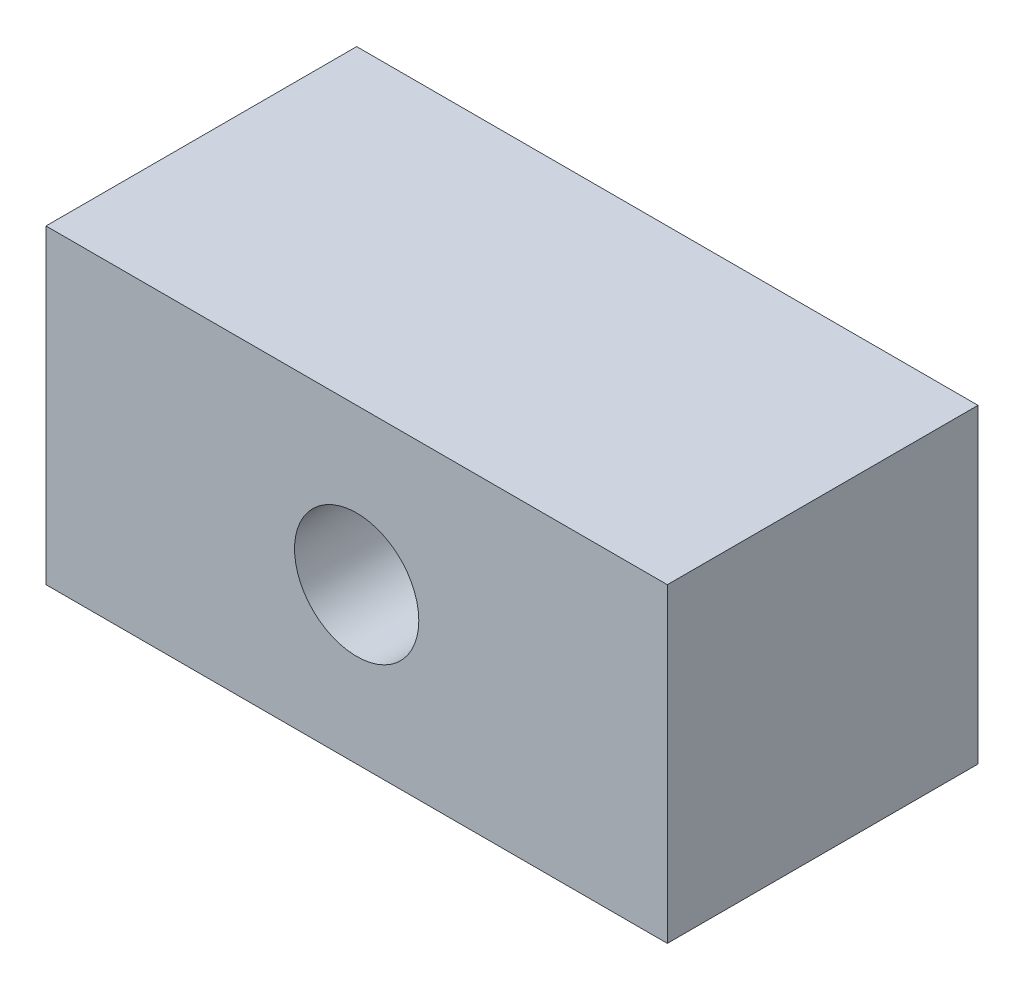
from build123d import *

# Parameters (mm, degrees)
SKETCH1_W           = 40
SKETCH1_H           = 20
BOSS_EXTRUDE1_DEPTH = 10
SKETCH2_R           = 4
CUT_EXTRUDE1_DEPTH  = 46.82575695


with BuildPart() as part:
    # Sketch1 → Boss-Extrude1 (new, symmetric)
    with BuildSketch(Plane.XY):
        with Locations((20, 10)):
            Rectangle(SKETCH1_W, SKETCH1_H)
    extrude(amount=BOSS_EXTRUDE1_DEPTH, both=True)

    # Sketch2 → Cut-Extrude1 (cut, through all)
    with BuildSketch(Plane.XY):
        with Locations((20, 10)):
            Circle(SKETCH2_R)
    extrude(amount=CUT_EXTRUDE1_DEPTH, mode=Mode.SUBTRACT)


solid = part.part
